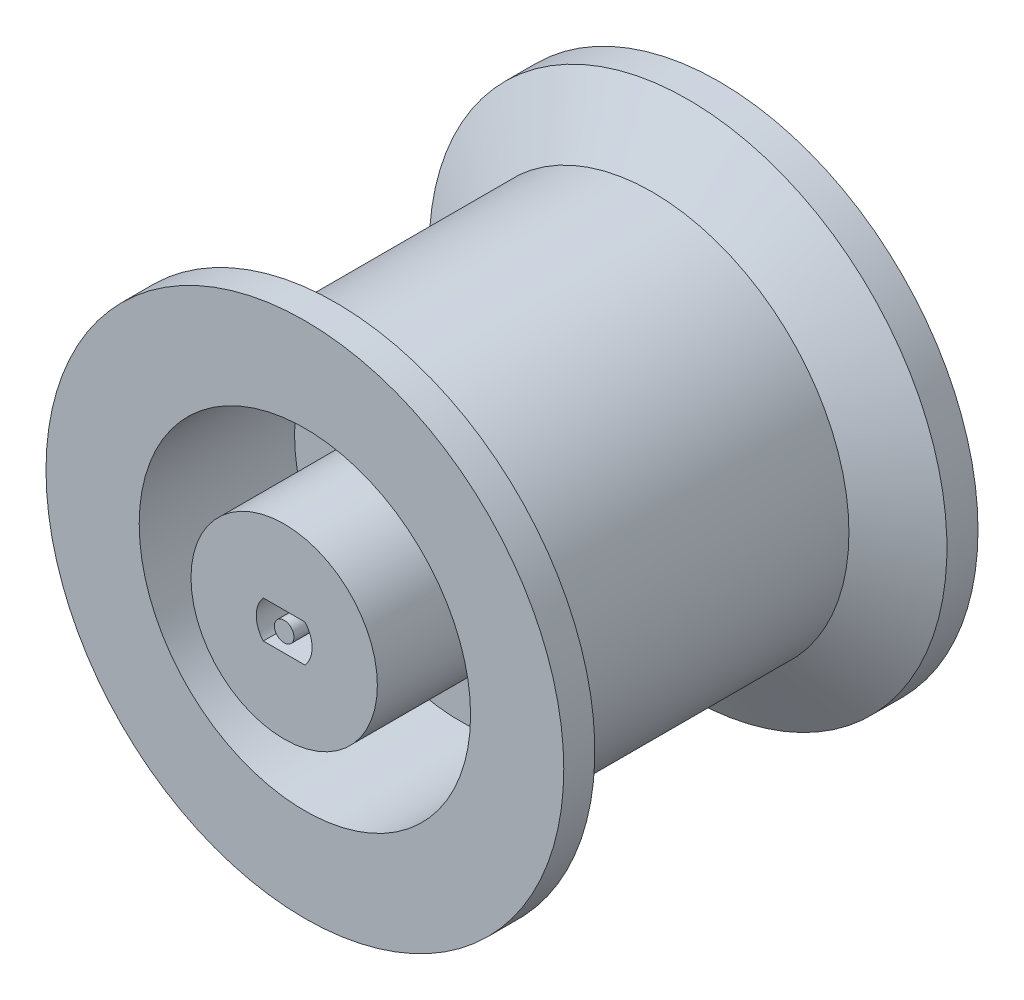
from build123d import *

# Parameters (mm, degrees)
ESQUISSE1_R                  = 25
ESQUISSE1_R_2                = 8
BOSS_EXTRU_1_DEPTH           = 20
ESQUISSE2_R                  = 16
ENL_V_MAT_EXTRU_1_DEPTH      = 15
ESQUISSE3_R                  = 2.5
ENL_V_MAT_EXTRU_2_DEPTH      = 44.301270189
R_P_TITION_CIRCULAIRE1_COUNT = 5
BOSS_EXTRU_2_DEPTH           = 17
BOSS_EXTRU_2_DEPTH_BACK      = 12
ESQUISSE4_R                  = 9
ESQUISSE4_R_2                = 8
BOSS_EXTRU_7_START           = -29
ESQUISSE13_R                 = 8
BOSS_EXTRU_7_DEPTH           = 29
ENL_V_MAT_EXTRU_3_DEPTH      = 7.7
ESQUISSE12_R                 = 0.945
BOSS_EXTRU_6_DEPTH           = 7.7


with BuildPart() as part:
    # Esquisse1 → Boss.-Extru.1 (new, symmetric)
    with BuildSketch(Plane.XY):
        Circle(ESQUISSE1_R)
        Circle(ESQUISSE1_R_2, mode=Mode.SUBTRACT)
    extrude(amount=BOSS_EXTRU_1_DEPTH, both=True)

    # Esquisse2 → Enlèv. mat.-Extru.1 (cut)
    with BuildSketch(Plane.XY.offset(20)):
        Circle(ESQUISSE2_R)
    enl_v_mat_extru_1 = extrude(amount=-ENL_V_MAT_EXTRU_1_DEPTH, mode=Mode.SUBTRACT)

    # Symétrie1: Enlèv. mat.-Extru.1 across plane
    add(enl_v_mat_extru_1.mirror(Plane.XY), mode=Mode.SUBTRACT)

    # Esquisse3 → Enlèv. mat.-Extru.2 (cut, through all)
    with BuildSketch(Plane.XY.offset(5)):
        with Locations((0, 12)):
            Circle(ESQUISSE3_R)
    enl_v_mat_extru_2 = extrude(amount=-ENL_V_MAT_EXTRU_2_DEPTH, mode=Mode.SUBTRACT)

    # Répétition circulaire1: Enlèv. mat.-Extru.2 ×5 about axis
    r_p_tition_circulaire1_axis = Axis((0, 0, 0), (0, 0, 1))
    for i in range(1, R_P_TITION_CIRCULAIRE1_COUNT):
        add(enl_v_mat_extru_2.rotate(r_p_tition_circulaire1_axis, i * 360 / R_P_TITION_CIRCULAIRE1_COUNT), mode=Mode.SUBTRACT)

    # Esquisse4 → Boss.-Extru.2 (add, two sides: drawn at the far end of the back side and taken through both)
    with BuildSketch(Plane.XY.offset(5).offset(-BOSS_EXTRU_2_DEPTH_BACK)):
        Circle(ESQUISSE4_R)
        Circle(ESQUISSE4_R_2, mode=Mode.SUBTRACT)
    extrude(amount=BOSS_EXTRU_2_DEPTH + BOSS_EXTRU_2_DEPTH_BACK)

    # Esquisse5 → Enlèvement de matière-Révolution1 (revolve, cut)
    with BuildSketch(Plane(origin=(0, 0, 0), x_dir=(1, 0, 0), z_dir=(0, 1, 0))):
        Polygon((-25, 17), (-19, 13.535898385), (-19, -13.535898385), (-25, -17), align=None)
    revolve(axis=Axis((0, 0, -25.284593115), (0, 0, 1)), mode=Mode.SUBTRACT)

    # Esquisse13 → Boss.-Extru.7 (add)
    with BuildSketch(Plane.XY.offset(22).offset(BOSS_EXTRU_7_START)):
        Circle(ESQUISSE13_R)
    extrude(amount=BOSS_EXTRU_7_DEPTH)

    # Esquisse11 → Enlèv. mat.-Extru.3 (cut)
    with BuildSketch(Plane.XY.offset(22)):
        with BuildLine():
            Line((-2.015, 1.8), (2.015, 1.8))
            ThreePointArc((2.015, 1.8), (2.695784465, 0), (2.015, -1.8))
            Line((2.015, -1.8), (-2.015, -1.8))
            ThreePointArc((-2.015, -1.8), (-2.695784465, 0), (-2.015, 1.8))
        make_face()
    extrude(amount=-ENL_V_MAT_EXTRU_3_DEPTH, mode=Mode.SUBTRACT)

    # Esquisse12 → Boss.-Extru.6 (add)
    with BuildSketch(Plane.XY.offset(14.3)):
        Circle(ESQUISSE12_R)
    extrude(amount=BOSS_EXTRU_6_DEPTH)


solid = part.part
